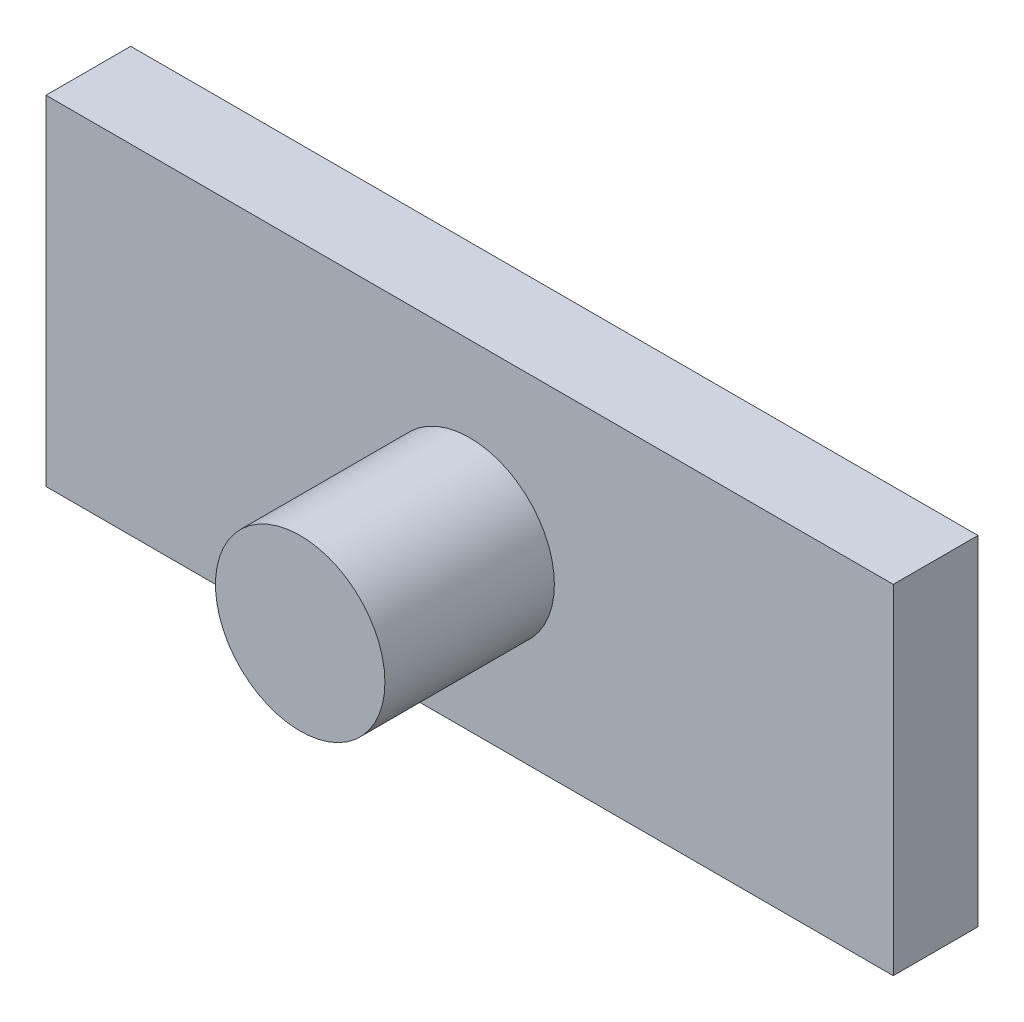
from build123d import *

# Parameters (mm, degrees)
SKETCH_2_W      = 100
SKETCH_2_H      = 40
EXTRUDE_1_DEPTH = 10
SKETCH_3_R      = 10
EXTRUDE_2_DEPTH = 20


with BuildPart() as part:
    # 草图2 → 凸台-拉伸1 (new body)
    with BuildSketch(Plane.XY):
        Rectangle(SKETCH_2_W, SKETCH_2_H)
    extrude(amount=EXTRUDE_1_DEPTH)

    # 草图3 → 凸台-拉伸2 (add)
    with BuildSketch(Plane.XY.offset(10)):
        Circle(SKETCH_3_R)
    extrude(amount=EXTRUDE_2_DEPTH)


solid = part.part
